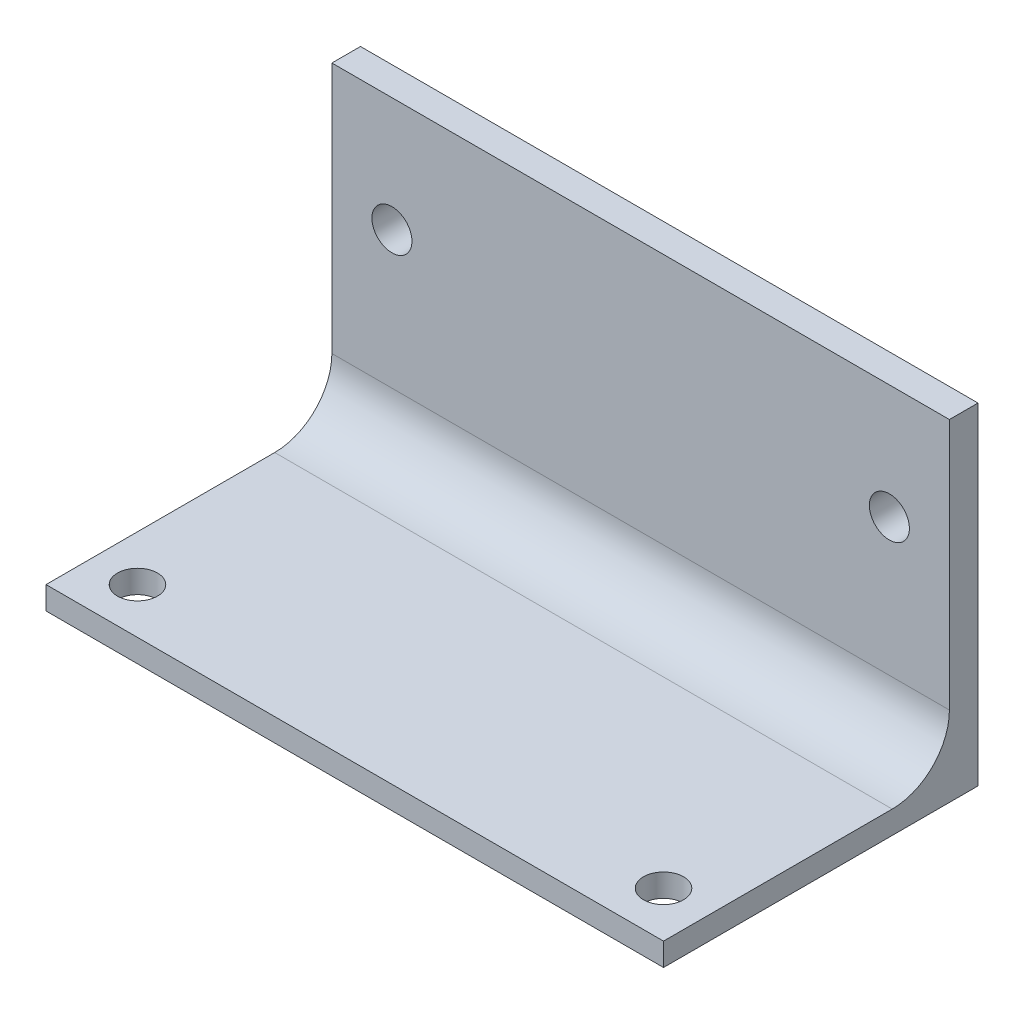
from build123d import *

# Parameters (mm, degrees)
SKETCH1_W           = 54
SKETCH1_H           = 25
SKETCH1_R           = 1.75
BOSS_EXTRUDE1_DEPTH = 2
SKETCH2_W           = 54
SKETCH2_H           = 2.5
BOSS_EXTRUDE2_DEPTH = 27
SKETCH3_W           = 54
SKETCH3_H           = 2.5
BOSS_EXTRUDE3_DEPTH = 2
SKETCH4_R           = 1.75
CUT_EXTRUDE1_DEPTH  = 27
FILLET1_R           = 5


with BuildPart() as part:
    # Sketch1 → Boss-Extrude1 (new body)
    with BuildSketch(Plane(origin=(0, 0, 0), x_dir=(1, 0, 0), z_dir=(0, 1, 0))):
        with Locations((27, 12.5)):
            Rectangle(SKETCH1_W, SKETCH1_H)
        with Locations(Location((4, 4, 0), (0, 0, 270))):
            Circle(SKETCH1_R, mode=Mode.SUBTRACT)
        with Locations(Location((50, 4, 0), (0, 0, 270))):
            Circle(SKETCH1_R, mode=Mode.SUBTRACT)
    extrude(amount=BOSS_EXTRUDE1_DEPTH)



with BuildPart() as body_2:
    # Sketch2 → Boss-Extrude2 (new body)
    with BuildSketch(Plane(origin=(0, 2, 0), x_dir=(1, 0, 0), z_dir=(0, 1, 0))):
        with Locations((27, 26.25)):
            Rectangle(SKETCH2_W, SKETCH2_H)
    extrude(amount=BOSS_EXTRUDE2_DEPTH)


with BuildPart() as part_1:
    add(part.part)

    add(body_2.part)  # Boss-Extrude3 merges body 2
    # Sketch3 → Boss-Extrude3 (add)
    with BuildSketch(Plane.XZ.offset(-2)):
        with Locations((27, -26.25)):
            Rectangle(SKETCH3_W, SKETCH3_H)
    extrude(amount=BOSS_EXTRUDE3_DEPTH)

    # Sketch4 → Cut-Extrude1 (cut)
    with BuildSketch(Plane.XY.offset(-25)):
        with Locations((5.25, 19)):
            Circle(SKETCH4_R)
        with Locations((48.75, 19)):
            Circle(SKETCH4_R)
    extrude(amount=-CUT_EXTRUDE1_DEPTH, mode=Mode.SUBTRACT)

    # Fillet1
    fillet1_edges = [part_1.edges().sort_by_distance(p)[0] for p in [
        (27, 2, -25),
    ]]
    fillet(fillet1_edges, radius=FILLET1_R)


solid = part_1.part
